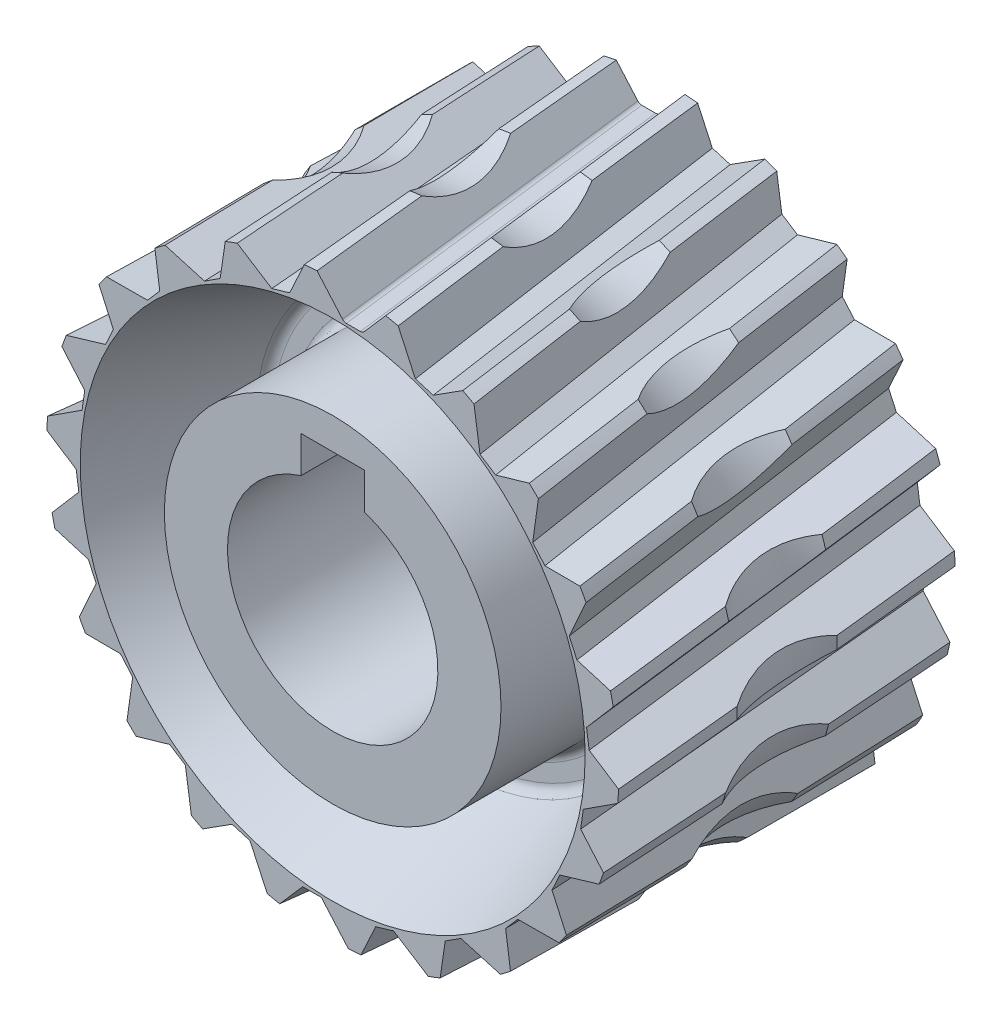
from build123d import *

# Parameters (mm, degrees)
SKETCH2_R               = 28.575
SKETCH2_R_2             = 7.9375
BOSS_EXTRUDE1_DEPTH     = 12.7
SKETCH3_R               = 7.9375
CHAMFER2_SIZE           = 2.54
FILLET1_R               = 0.7874
CUT_EXTRUDE1_DEPTH      = 43.359783404
CUT_EXTRUDE1_DEPTH_BACK = 43.359783404
SKETCH5_W               = 4.7752
SKETCH5_H               = 10.3251
SKETCH8_W               = 25.4
SKETCH8_H               = 7.448431148
FILLET2_R               = 0.381
CIRPATTERN1_COUNT       = 22


with BuildPart() as part:
    # Sketch2 → Boss-Extrude1 (new, symmetric)
    with BuildSketch(Plane.XY):
        Circle(SKETCH2_R)
        Circle(SKETCH2_R_2, mode=Mode.SUBTRACT)
    extrude(amount=BOSS_EXTRUDE1_DEPTH, both=True)

    # Sketch3 → Cut-Revolve1 (revolve, cut)
    with BuildSketch(Plane(origin=(0, 0, 0), x_dir=(0, 0, -1), z_dir=(1, 0, 0)), mode=Mode.PRIVATE) as cut_revolve1_sk:
        with Locations((0, 28.575)):
            Circle(SKETCH3_R)
    revolve(cut_revolve1_sk.sketch.rotate(Axis((0, 0, 12.7), (0, 0, -1)), 90), axis=Axis((0, 0, 12.7), (0, 0, -1)), mode=Mode.SUBTRACT)

    # Sketch4 → Cut-Revolve2 (revolve, cut)
    with BuildSketch(Plane(origin=(0, 0, 0), x_dir=(0, 0, -1), z_dir=(1, 0, 0)), mode=Mode.PRIVATE) as cut_revolve2_sk:
        Polygon((12.7, 12.7), (2.54, 12.7), (2.54, 15.24), (12.7, 19.05), align=None)
    cut_revolve2 = revolve(cut_revolve2_sk.sketch.rotate(Axis((0, 0, -1.169274469), (0, 0, -1)), 90), axis=Axis((0, 0, -1.169274469), (0, 0, -1)), mode=Mode.SUBTRACT)

    # Mirror1: Cut-Revolve2 across plane
    add(cut_revolve2.mirror(Plane.XY), mode=Mode.SUBTRACT)

    # Chamfer2
    chamfer2_edges = [part.edges().sort_by_distance(p)[0] for p in [
        (-28.575, 0, -12.7),
        (-28.575, 0, 12.7),
    ]]
    chamfer(chamfer2_edges, length=CHAMFER2_SIZE)

    # Fillet1
    fillet1_edges = [part.edges().sort_by_distance(p)[0] for p in [
        (-12.7, 0, -2.54),
        (-15.24, 0, -2.54),
        (-12.7, 0, 2.54),
        (-15.24, 0, 2.54),
    ]]
    fillet(fillet1_edges, radius=FILLET1_R)

    # Sketch5 → Cut-Extrude1 (cut, two sides: drawn at the far end of the back side and taken through both)
    with BuildSketch(Plane.XY.offset(-CUT_EXTRUDE1_DEPTH_BACK)):
        with Locations((0, 5.16255)):
            Rectangle(SKETCH5_W, SKETCH5_H)
    extrude(amount=CUT_EXTRUDE1_DEPTH + CUT_EXTRUDE1_DEPTH_BACK, mode=Mode.SUBTRACT)

    # Sketch8 → Cut-Revolve3 (revolve, cut)
    with BuildSketch(Plane(origin=(0, 0, 0), x_dir=(0, 0, -1), z_dir=(1, 0, 0)), mode=Mode.PRIVATE) as cut_revolve3_sk:
        with Locations((0, 25.314215574)):
            Rectangle(SKETCH8_W, SKETCH8_H)
    revolve(cut_revolve3_sk.sketch.rotate(Axis((0, 0, 0), (0, 0, 1)), 90), axis=Axis((0, 0, 0), (0, 0, 1)), mode=Mode.SUBTRACT)

    # Cut-Sweep1: sweep along a path in Sketch6
    with BuildLine(Plane(origin=(0, 24.13, 0), x_dir=(1, 0, 0), z_dir=(0, 1, 0))) as cut_sweep1_path:
        Line((1.949204904, -15.875), (-2.523925645, 20.555724812))
    # Sketch10 → Cut-Sweep1 (sweep, cut)
    with BuildSketch(Plane(origin=(1.949204904, 24.13, 15.875), x_dir=(-0.9925461516413219, 0, 0.12186934340514814), z_dir=(-0.12186934340514816, 0, -0.992546151641322))):
        Polygon((10.118481565, 5.967009498), (0.6985, -4.9022), (-0.6985, -4.9022), (-10.118481565, 5.967009498), align=None)
    cut_sweep1 = sweep(path=cut_sweep1_path.line, mode=Mode.SUBTRACT)

    # Fillet2
    fillet2_edges = [part.edges().sort_by_distance(p)[0] for p in [
        (-0.703745613, 19.2278, 0),
        (0.703745613, 19.2278, 0),
    ]]
    fillet(fillet2_edges, radius=FILLET2_R)

    # CirPattern1: Cut-Sweep1 ×22 about axis
    cirpattern1_axis = Axis((0, 0, 0), (0, 0, 1))
    for i in range(1, CIRPATTERN1_COUNT):
        add(cut_sweep1.rotate(cirpattern1_axis, i * 360 / CIRPATTERN1_COUNT), mode=Mode.SUBTRACT)


solid = part.part
